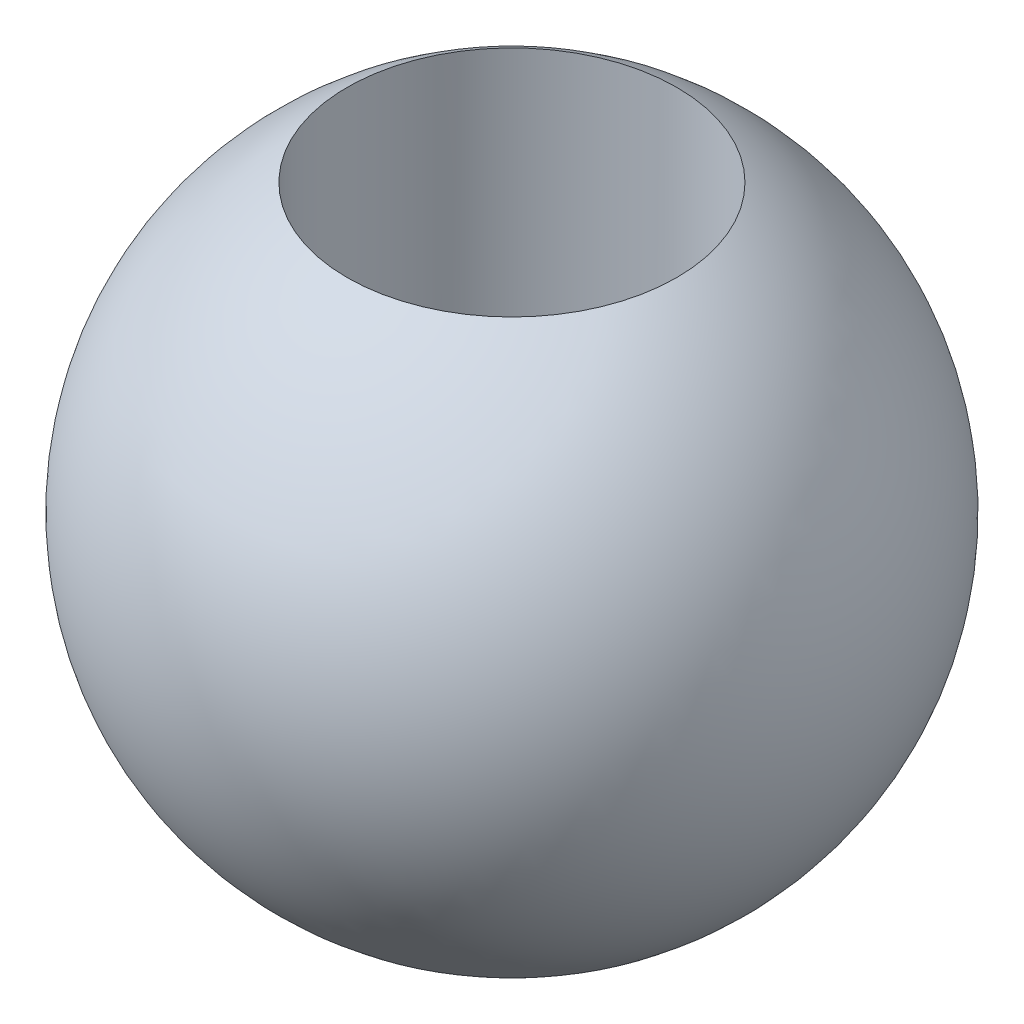
from build123d import *

# Parameters (mm, degrees)
SKETCH4_R          = 5
CUT_EXTRUDE1_DEPTH = 12.5


with BuildPart() as part:
    # Sketch1 → Revolve2 (revolve)
    with BuildSketch(Plane.XY):
        with BuildLine():
            Line((0, -10), (0, 10))
            ThreePointArc((0, 10), (10, 0), (0, -10))
        make_face()
    revolve(axis=Axis((0, 10, 0), (0, -1, 0)))

    # Sketch4 → Cut-Extrude1 (cut)
    with BuildSketch(Plane(origin=(0, 10, 0), x_dir=(1, 0, 0), z_dir=(0, 1, 0))):
        with Locations(Location((0, 0, 0), (0, 0, 270))):
            Circle(SKETCH4_R)
    extrude(amount=-CUT_EXTRUDE1_DEPTH, mode=Mode.SUBTRACT)


solid = part.part
